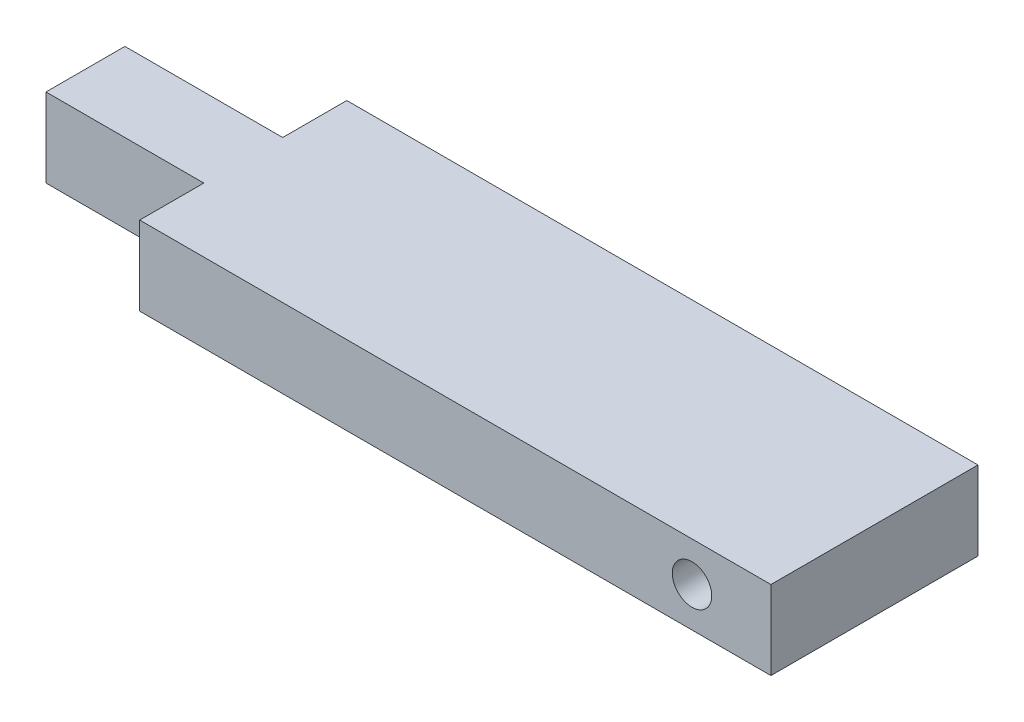
from build123d import *

# Parameters (mm, degrees)
SKETCH1_W           = 101.6
SKETCH1_H           = 33.330801688
BOSS_EXTRUDE1_DEPTH = 12.7
SKETCH2_W           = 12.7
SKETCH2_H           = 12.7
BOSS_EXTRUDE2_DEPTH = 25.4
SKETCH4_R           = 3.175
CUT_EXTRUDE2_DEPTH  = 108.679117479


with BuildPart() as part:
    # Sketch1 → Boss-Extrude1 (new body)
    with BuildSketch(Plane(origin=(0, 0, 0), x_dir=(1, 0, 0), z_dir=(0, 1, 0))):
        with Locations((50.8, 16.665400844)):
            Rectangle(SKETCH1_W, SKETCH1_H)
    extrude(amount=BOSS_EXTRUDE1_DEPTH)

    # Sketch2 → Boss-Extrude2 (add)
    with BuildSketch(Plane.ZY):
        with Locations((-16.665400844, 6.35)):
            Rectangle(SKETCH2_W, SKETCH2_H)
    extrude(amount=BOSS_EXTRUDE2_DEPTH)

    # Sketch4 → Cut-Extrude2 (cut, through all)
    with BuildSketch(Plane.XY):
        with Locations((88.9, 6.35)):
            Circle(SKETCH4_R)
    extrude(amount=-CUT_EXTRUDE2_DEPTH, mode=Mode.SUBTRACT)


solid = part.part
